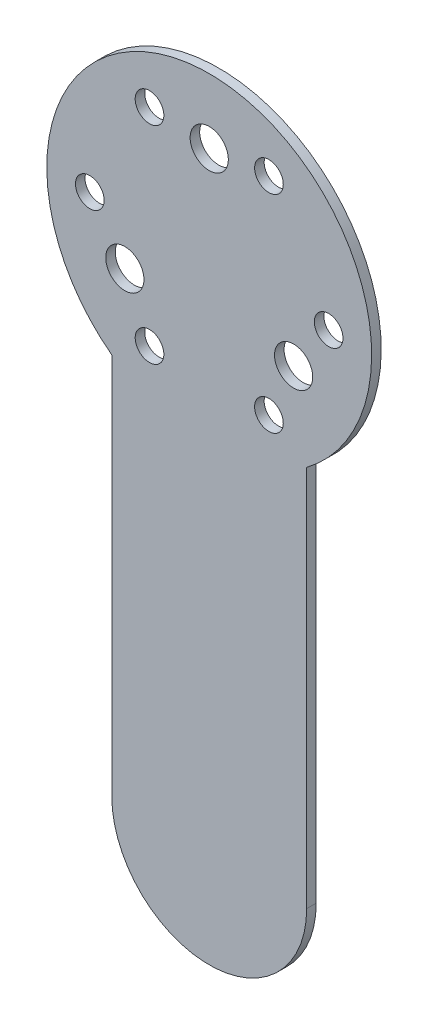
from build123d import *

# Parameters (mm, degrees)
SKETCH2_R           = 2
SKETCH2_R_2         = 1.5
BOSS_EXTRUDE2_DEPTH = 1


with BuildPart() as part:
    # Sketch2 → Boss-Extrude2 (new body)
    with BuildSketch(Plane.XY):
        with BuildLine():
            Line((-10.2, -13.6), (-10.2, -53.6))
            ThreePointArc((-10.2, -53.6), (0, -63.8), (10.2, -53.6))
            Line((10.2, -53.6), (10.2, -13.6))
            ThreePointArc((10.2, -13.6), (0, 17), (-10.2, -13.6))
        make_face()
        with Locations((0, 10.2)):
            Circle(SKETCH2_R, mode=Mode.SUBTRACT)
        with Locations((8.833459119, -5.1)):
            Circle(SKETCH2_R, mode=Mode.SUBTRACT)
        with Locations((-8.833459119, -5.1)):
            Circle(SKETCH2_R, mode=Mode.SUBTRACT)
        with Locations((-12.5, 0)):
            Circle(SKETCH2_R_2, mode=Mode.SUBTRACT)
        with Locations((-6.25, 10.825317547)):
            Circle(SKETCH2_R_2, mode=Mode.SUBTRACT)
        with Locations((6.25, 10.825317547)):
            Circle(SKETCH2_R_2, mode=Mode.SUBTRACT)
        with Locations((12.5, 0)):
            Circle(SKETCH2_R_2, mode=Mode.SUBTRACT)
        with Locations((6.25, -10.825317547)):
            Circle(SKETCH2_R_2, mode=Mode.SUBTRACT)
        with Locations((-6.25, -10.825317547)):
            Circle(SKETCH2_R_2, mode=Mode.SUBTRACT)
    extrude(amount=BOSS_EXTRUDE2_DEPTH)


solid = part.part
